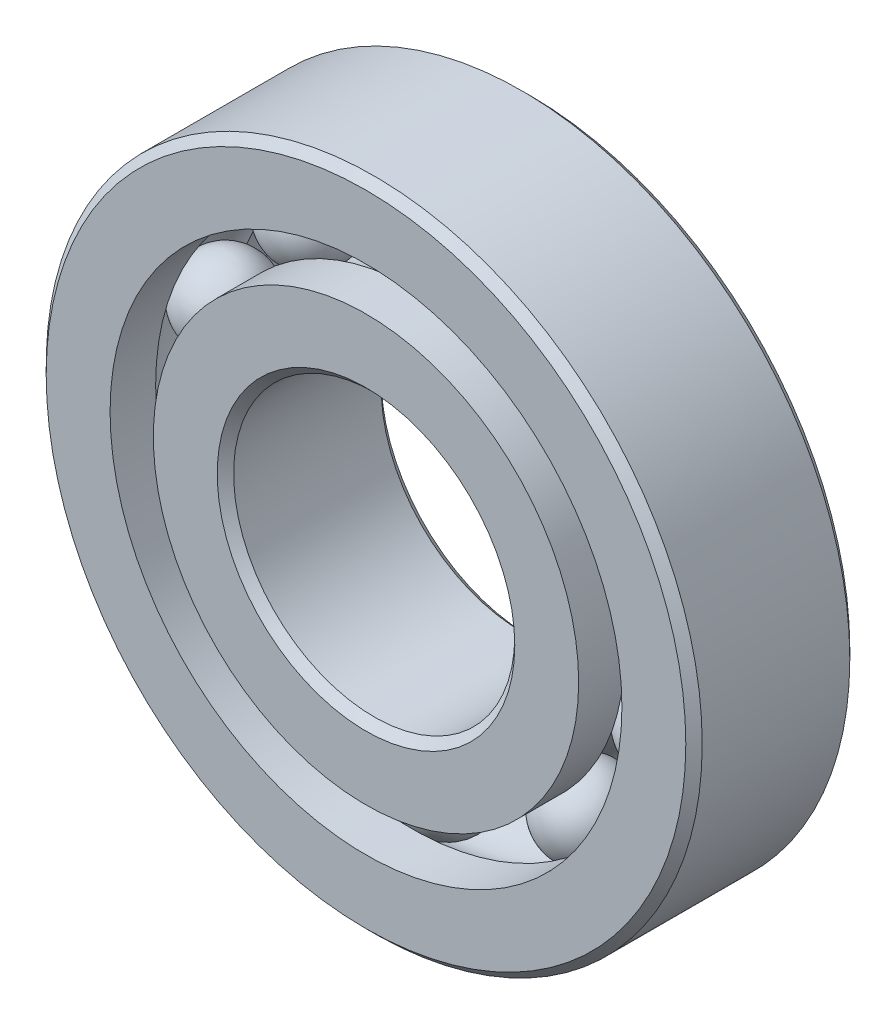
from build123d import *

# Parameters (mm, degrees)
CIRPATTERN1_COUNT = 10


with BuildPart() as part:
    # Sketch1 → Revolve1 (revolve)
    with BuildSketch(Plane(origin=(0, 0, 0), x_dir=(0, 0, -1), z_dir=(1, 0, 0)), mode=Mode.PRIVATE) as revolve1_sk:
        with BuildLine():
            Line((2.5003125, 11.1125), (-2.5003125, 11.1125))
            Line((-2.5003125, 11.1125), (-2.778125, 10.8346875))
            Line((-2.778125, 10.8346875), (-2.778125, 8.670192308))
            Line((-2.778125, 8.670192308), (-1.234722222, 8.670192308))
            ThreePointArc((-1.234722222, 8.670192308), (0, 9.373249624), (1.234722222, 8.670192308))
            Line((1.234722222, 8.670192308), (2.778125, 8.670192308))
            Line((2.778125, 8.670192308), (2.778125, 10.8346875))
            Line((2.778125, 10.8346875), (2.5003125, 11.1125))
        make_face()
    revolve(revolve1_sk.sketch.rotate(Axis((0, 0, 2.778125), (0, 0, -1)), 90), axis=Axis((0, 0, 2.778125), (0, 0, -1)))


with BuildPart() as body_2:
    # Sketch3 → Revolve3 (revolve)
    with BuildSketch(Plane(origin=(0, 0, 0), x_dir=(0, 0, -1), z_dir=(1, 0, 0)), mode=Mode.PRIVATE) as revolve3_sk:
        with BuildLine():
            Line((-2.778125, 7.204807692), (-1.234722222, 7.204807692))
            ThreePointArc((-1.234722222, 7.204807692), (0, 6.501750376), (1.234722222, 7.204807692))
            Line((1.234722222, 7.204807692), (2.778125, 7.204807692))
            Line((2.778125, 7.204807692), (2.778125, 5.0403125))
            Line((2.778125, 5.0403125), (2.5003125, 4.7625))
            Line((2.5003125, 4.7625), (-2.5003125, 4.7625))
            Line((-2.5003125, 4.7625), (-2.778125, 5.0403125))
            Line((-2.778125, 5.0403125), (-2.778125, 7.204807692))
        make_face()
    revolve(revolve3_sk.sketch.rotate(Axis((0, 0, 2.778125), (0, 0, -1)), 90), axis=Axis((0, 0, 2.778125), (0, 0, -1)))


with BuildPart() as body_3:
    # Sketch4 → Revolve4 (revolve)
    with BuildSketch(Plane(origin=(0, 0, 0), x_dir=(0, 0, -1), z_dir=(1, 0, 0))):
        with BuildLine():
            Line((-1.435749624, 7.9375), (1.435749624, 7.9375))
            ThreePointArc((1.435749624, 7.9375), (0, 9.373249624), (-1.435749624, 7.9375))
        make_face()
    revolve(axis=Axis((0, 7.9375, 1.435749624), (0, 0, -1)))


with BuildPart() as cirpattern1_1:
    # CirPattern1: pattern copy
    add(body_3.part.rotate(Axis((0, 0, 0), (0, 0, 1)), 1 * 360 / CIRPATTERN1_COUNT))


with BuildPart() as cirpattern1_2:
    # CirPattern1: pattern copy
    add(body_3.part.rotate(Axis((0, 0, 0), (0, 0, 1)), 2 * 360 / CIRPATTERN1_COUNT))


with BuildPart() as cirpattern1_3:
    # CirPattern1: pattern copy
    add(body_3.part.rotate(Axis((0, 0, 0), (0, 0, 1)), 3 * 360 / CIRPATTERN1_COUNT))


with BuildPart() as cirpattern1_4:
    # CirPattern1: pattern copy
    add(body_3.part.rotate(Axis((0, 0, 0), (0, 0, 1)), 4 * 360 / CIRPATTERN1_COUNT))


with BuildPart() as cirpattern1_5:
    # CirPattern1: pattern copy
    add(body_3.part.rotate(Axis((0, 0, 0), (0, 0, 1)), 5 * 360 / CIRPATTERN1_COUNT))


with BuildPart() as cirpattern1_6:
    # CirPattern1: pattern copy
    add(body_3.part.rotate(Axis((0, 0, 0), (0, 0, 1)), 6 * 360 / CIRPATTERN1_COUNT))


with BuildPart() as cirpattern1_7:
    # CirPattern1: pattern copy
    add(body_3.part.rotate(Axis((0, 0, 0), (0, 0, 1)), 7 * 360 / CIRPATTERN1_COUNT))


with BuildPart() as cirpattern1_8:
    # CirPattern1: pattern copy
    add(body_3.part.rotate(Axis((0, 0, 0), (0, 0, 1)), 8 * 360 / CIRPATTERN1_COUNT))


with BuildPart() as cirpattern1_9:
    # CirPattern1: pattern copy
    add(body_3.part.rotate(Axis((0, 0, 0), (0, 0, 1)), 9 * 360 / CIRPATTERN1_COUNT))


solid = Compound([part.part, body_2.part, body_3.part, cirpattern1_1.part, cirpattern1_2.part, cirpattern1_3.part, cirpattern1_4.part, cirpattern1_5.part, cirpattern1_6.part, cirpattern1_7.part, cirpattern1_8.part, cirpattern1_9.part])
